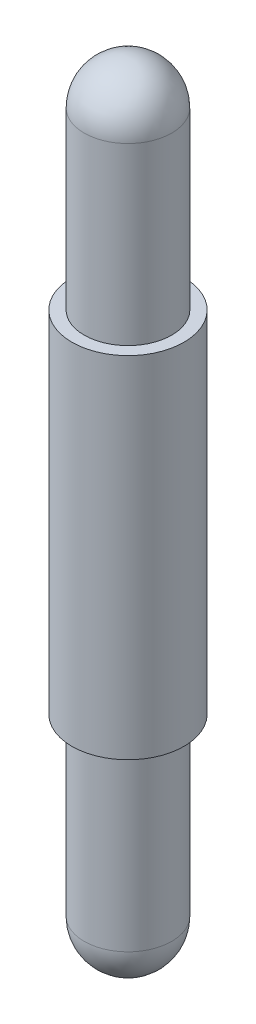
from build123d import *


with BuildPart() as part:
    # Sketch1 → Revolve1 (revolve)
    with BuildSketch(Plane.XY, mode=Mode.PRIVATE) as revolve1_sk:
        Polygon((12.5, 73.991760417), (0, 73.991760417), (0, -126.008239583), (12.5, -126.008239583), (12.5, -76.008239583), (16, -76.008239583), (16, 23.991760417), (12.5, 23.991760417), align=None)
        with BuildLine():
            Line((0, 86.491760417), (0, 73.991760417))
            Line((0, 73.991760417), (12.5, 73.991760417))
            ThreePointArc((12.5, 73.991760417), (8.838834765, 82.830595182), (0, 86.491760417))
        make_face()
        with BuildLine():
            Line((12.5, -126.008239583), (0, -126.008239583))
            Line((0, -126.008239583), (0, -138.508239583))
            ThreePointArc((0, -138.508239583), (8.838834765, -134.847074348), (12.5, -126.008239583))
        make_face()
    revolve(revolve1_sk.sketch.rotate(Axis((0, 86.491760417, 0), (0, -1, 0)), 90), axis=Axis((0, 86.491760417, 0), (0, -1, 0)))


solid = part.part
